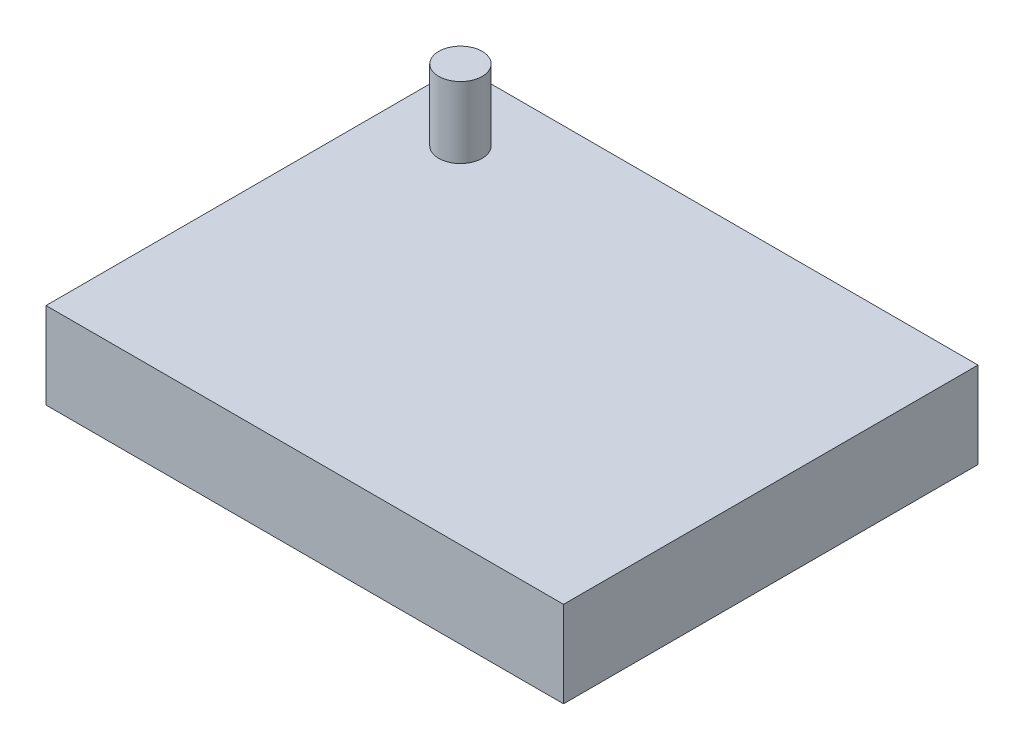
from build123d import *

# Parameters (mm, degrees)
SKETCH1_W           = 190.636951824
SKETCH1_H           = 152.660422476
BOSS_EXTRUDE1_DEPTH = 31.75
SKETCH7_R           = 8.001
BOSS_EXTRUDE2_DEPTH = 26.162


with BuildPart() as part:
    # Sketch1 → Boss-Extrude1 (new body)
    with BuildSketch(Plane(origin=(0, 0, 0), x_dir=(1, 0, 0), z_dir=(0, 1, 0))):
        Rectangle(SKETCH1_W, SKETCH1_H)
    extrude(amount=BOSS_EXTRUDE1_DEPTH)

    # Sketch7 → Boss-Extrude2 (add)
    with BuildSketch(Plane(origin=(0, 31.75, 0), x_dir=(1, 0, 0), z_dir=(0, 1, 0))):
        with Locations(Location((-69.918475912, 50.930211238, 0), (0, 0, 90))):
            Circle(SKETCH7_R)
    extrude(amount=BOSS_EXTRUDE2_DEPTH)


solid = part.part
